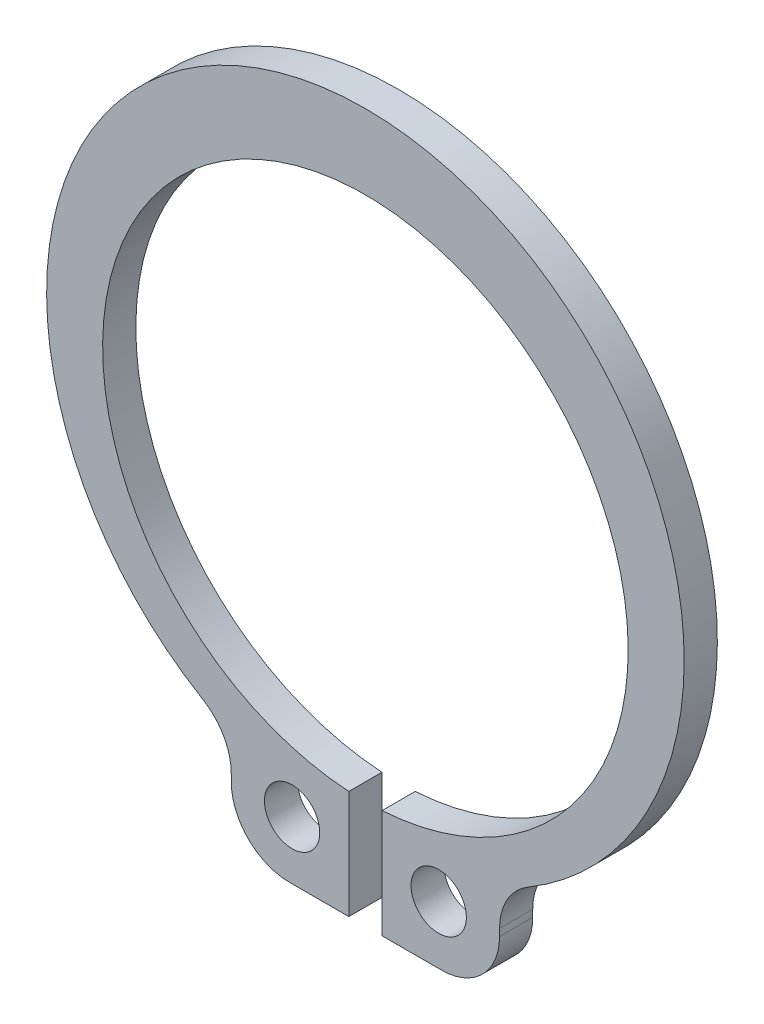
from build123d import *

# Parameters (mm, degrees)
BOSS_EXTRUDE1_DEPTH = 1.2
SKETCH2_R           = 1
CUT_EXTRUDE1_DEPTH  = 18.715124188
FILLET1_R           = 2.1
FILLET2_R           = 2.1


with BuildPart() as part:
    # Sketch1 → Boss-Extrude1 (new body)
    with BuildSketch(Plane.XY):
        with BuildLine():
            Line((-4.85, -9.779813485), (-4.85, -13.4))
            Line((-4.85, -13.4), (-0.6, -13.4))
            Line((-0.6, -13.4), (-0.6, -9.481033699))
            ThreePointArc((-0.6, -9.481033699), (0, 9.5), (0.6, -9.481033699))
            Line((0.6, -9.481033699), (0.6, -13.4))
            Line((0.6, -13.4), (4.85, -13.4))
            Line((4.85, -13.4), (4.85, -9.779813485))
            ThreePointArc((4.85, -9.779813485), (0, 12.2), (-4.85, -9.779813485))
        make_face()
    extrude(amount=BOSS_EXTRUDE1_DEPTH)

    # Sketch2 → Cut-Extrude1 (cut, through all)
    with BuildSketch(Plane(origin=(0, 0, 0), x_dir=(-1, 0, 0), z_dir=(0, 0, -1))):
        with Locations((-2.65, -11.3)):
            Circle(SKETCH2_R)
        with Locations((2.65, -11.3)):
            Circle(SKETCH2_R)
    extrude(amount=-CUT_EXTRUDE1_DEPTH, mode=Mode.SUBTRACT)

    # Fillet1
    fillet1_edges = [part.edges().sort_by_distance(p)[0] for p in [
        (4.85, -9.779813485, 0.6),
        (-4.85, -9.779813485, 0.6),
    ]]
    fillet(fillet1_edges, radius=FILLET1_R)

    # Fillet2
    fillet2_edges = [part.edges().sort_by_distance(p)[0] for p in [
        (4.85, -13.4, 0.6),
        (-4.85, -13.4, 0.6),
    ]]
    fillet(fillet2_edges, radius=FILLET2_R)


solid = part.part
